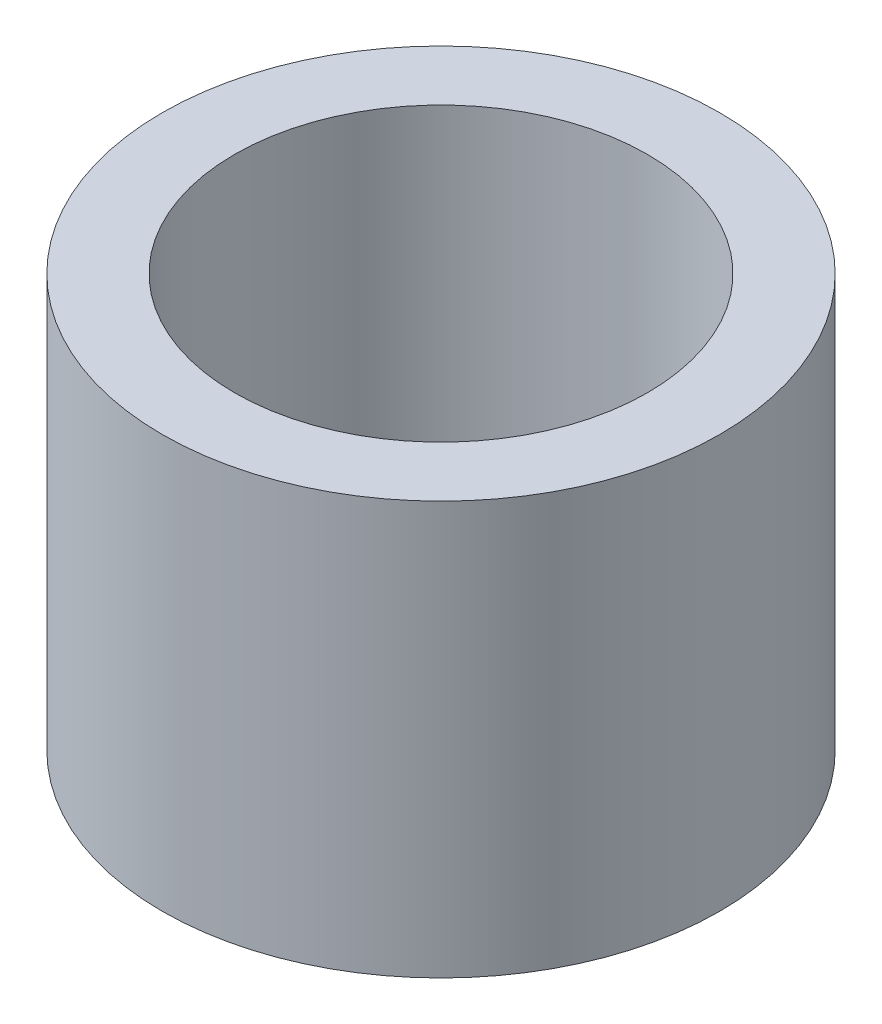
from build123d import *

# Parameters (mm, degrees)
SKETCH1_R           = 8.5725
SKETCH1_R_2         = 6.35
BOSS_EXTRUDE1_DEPTH = 12.7


with BuildPart() as part:
    # Sketch1 → Boss-Extrude1 (new body)
    with BuildSketch(Plane(origin=(0, 0, 0), x_dir=(1, 0, 0), z_dir=(0, 1, 0))):
        with Locations(Location((0, 0, 0), (0, 0, 270))):
            Circle(SKETCH1_R)
        with Locations(Location((0, 0, 0), (0, 0, 270))):
            Circle(SKETCH1_R_2, mode=Mode.SUBTRACT)
    extrude(amount=BOSS_EXTRUDE1_DEPTH)


solid = part.part
